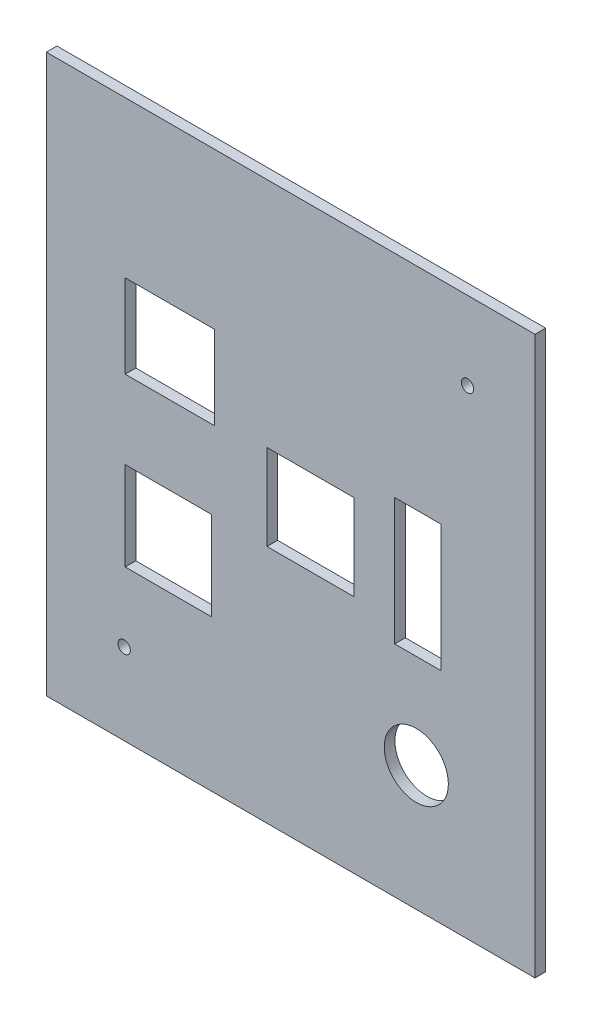
from build123d import *

# Parameters (mm, degrees)
SKETCH2_W           = 116.725527873
SKETCH2_H           = 133.165089742
BOSS_EXTRUDE1_DEPTH = 2.54
SKETCH3_W           = 20.623543236
SKETCH3_H           = 21.169862262
SKETCH3_W_2         = 20.760122992
SKETCH3_H_2         = 20.48696348
SKETCH3_W_3         = 21.306442018
SKETCH3_H_3         = 19.940644453
CUT_EXTRUDE1_DEPTH  = 2.54
SKETCH5_R           = 7.656955564
CUT_EXTRUDE3_DEPTH  = 2.54
SKETCH7_W           = 11.00850593
SKETCH7_H           = 30.296913756
CUT_EXTRUDE4_DEPTH  = 2.54
SKETCH8_R           = 1.475
CUT_EXTRUDE6_DEPTH  = 2.95


with BuildPart() as part:
    # Sketch2 → Boss-Extrude1 (new body)
    with BuildSketch(Plane.XY.offset(8.89)):
        with Locations((105.793885205, -85.85721005)):
            Rectangle(SKETCH2_W, SKETCH2_H)
    extrude(amount=BOSS_EXTRUDE1_DEPTH)

    # Sketch3 → Cut-Extrude1 (cut)
    with BuildSketch(Plane.XY.offset(11.43)):
        with Locations((76.576493833, -105.769912046)):
            Rectangle(SKETCH3_W, SKETCH3_H)
        with Locations((110.51656333, -84.941499175)):
            Rectangle(SKETCH3_W_2, SKETCH3_H_2)
        with Locations((76.917943224, -66.503232044)):
            Rectangle(SKETCH3_W_3, SKETCH3_H_3)
    extrude(amount=-CUT_EXTRUDE1_DEPTH, mode=Mode.SUBTRACT)

    # Sketch5 → Cut-Extrude3 (cut)
    with BuildSketch(Plane.XY.offset(11.43)):
        with Locations((135.8, -122.65)):
            Circle(SKETCH5_R)
    extrude(amount=-CUT_EXTRUDE3_DEPTH, mode=Mode.SUBTRACT)

    # Sketch7 → Cut-Extrude4 (cut)
    with BuildSketch(Plane.XY.offset(11.43)):
        with Locations((136.149279083, -84.937713867)):
            Rectangle(SKETCH7_W, SKETCH7_H)
    extrude(amount=-CUT_EXTRUDE4_DEPTH, mode=Mode.SUBTRACT)

    # Sketch8 → Cut-Extrude6 (cut)
    with BuildSketch(Plane.XY.offset(11.43)):
        with Locations((66.015339877, -133.007279185)):
            Circle(SKETCH8_R)
        with Locations((148.032128518, -37.964511979)):
            Circle(SKETCH8_R)
    extrude(amount=-CUT_EXTRUDE6_DEPTH, mode=Mode.SUBTRACT)


solid = part.part
